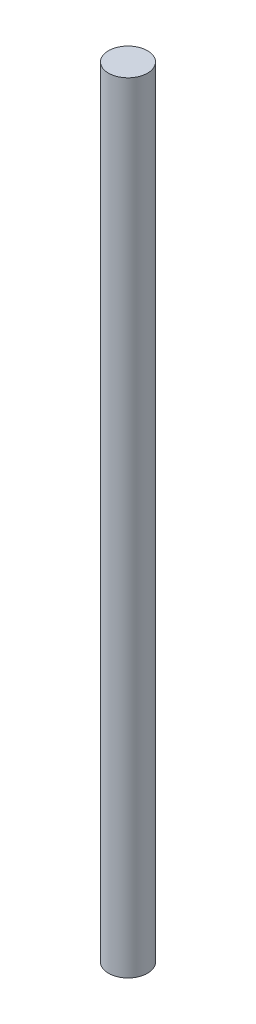
from build123d import *

# Parameters (mm, degrees)
SKETCH1_R           = 1
BOSS_EXTRUDE1_DEPTH = 20


with BuildPart() as part:
    # Sketch1 → Boss-Extrude1 (new, symmetric)
    with BuildSketch(Plane(origin=(0, 0, 0), x_dir=(1, 0, 0), z_dir=(0, 1, 0))):
        with Locations(Location((0, 0, 0), (0, 0, 270))):
            Circle(SKETCH1_R)
    extrude(amount=BOSS_EXTRUDE1_DEPTH, both=True)


solid = part.part
